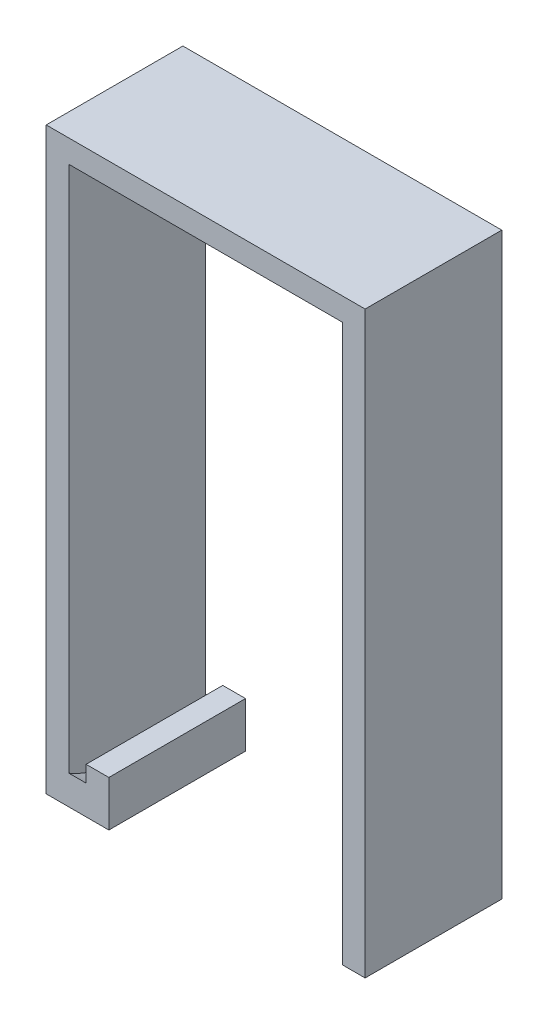
from build123d import *

# Parameters (mm, degrees)
SKETCH1_W           = 24
SKETCH1_H           = 12
BOSS_EXTRUDE1_DEPTH = 1
SKETCH2_W           = 12
SKETCH2_H           = 50.87
BOSS_EXTRUDE2_DEPTH = 2
BOSS_EXTRUDE3_DEPTH = 1.5
SKETCH5_W           = 12
SKETCH5_H           = 4
BOSS_EXTRUDE4_DEPTH = 2


with BuildPart() as part:
    # Sketch1 → Boss-Extrude1 (new, symmetric)
    with BuildSketch(Plane(origin=(0, 0, 0), x_dir=(1, 0, 0), z_dir=(0, 1, 0))):
        Rectangle(SKETCH1_W, SKETCH1_H)
    extrude(amount=BOSS_EXTRUDE1_DEPTH, both=True)

    # Sketch2 → Boss-Extrude2 (add)
    with BuildSketch(Plane.ZY.offset(12)):
        with Locations((0, -24.435)):
            Rectangle(SKETCH2_W, SKETCH2_H)
    boss_extrude2 = extrude(amount=BOSS_EXTRUDE2_DEPTH)

    # Mirror1: Boss-Extrude2 across plane
    add(boss_extrude2.mirror(Plane(origin=(0, 0, 0), x_dir=(0, 0, 1), z_dir=(1, 0, 0))))

    # Sketch4 → Boss-Extrude3 (add)
    with BuildSketch(Plane(origin=(-12, 0, 0), x_dir=(0, 0, -1), z_dir=(1, 0, 0))):
        with BuildLine():
            Line((-6, -47.300004682), (-6, -49.87))
            Line((-6, -49.87), (6, -49.87))
            Line((6, -49.87), (6, -47.300004682))
            ThreePointArc((6, -47.300004682), (0, -48.87), (-6, -47.300004682))
        make_face()
    extrude(amount=BOSS_EXTRUDE3_DEPTH)

    # Sketch5 → Boss-Extrude4 (add)
    with BuildSketch(Plane(origin=(-10.5, 0, 0), x_dir=(0, 0, -1), z_dir=(1, 0, 0))):
        with Locations((0, -47.87)):
            Rectangle(SKETCH5_W, SKETCH5_H)
    extrude(amount=BOSS_EXTRUDE4_DEPTH)


solid = part.part
